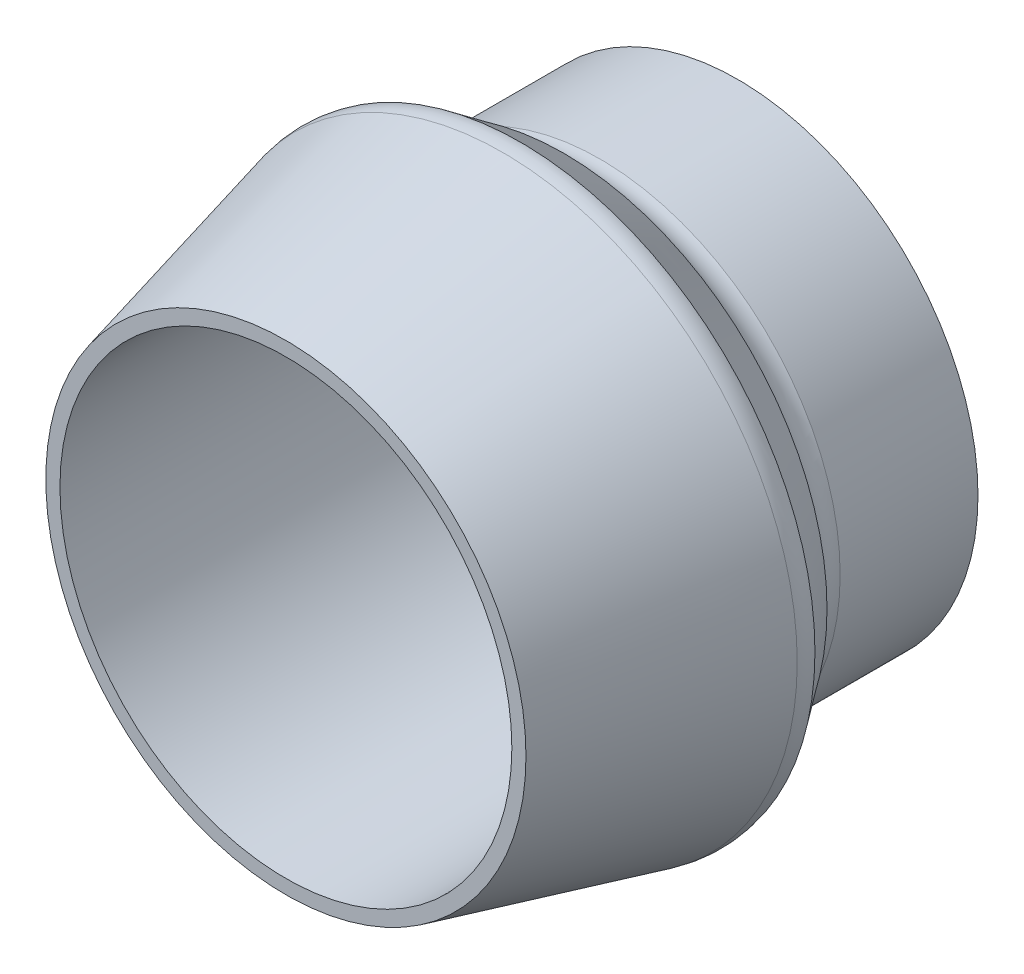
from build123d import *


with BuildPart() as part:
    # Esboço1 → Revolução4 (revolve)
    with BuildSketch(Plane(origin=(0, 0, 0), x_dir=(0, 0, -1), z_dir=(1, 0, 0)), mode=Mode.PRIVATE) as revolu_o4_sk:
        with BuildLine():
            Line((-36.699570276, 4.133360134), (-36.092161543, 3.695324027))
            ThreePointArc((-36.092161543, 3.695324027), (-35.905826449, 3.430249421), (-35.58663159, 3.374572178))
            Line((-35.58663159, 3.374572178), (-33.65, 3.374572178))
            Line((-33.65, 3.374572178), (-33.65, 3.175))
            Line((-33.65, 3.175), (-40, 3.175))
            Line((-40, 3.175), (-40, 3.3734375))
            Line((-40, 3.3734375), (-36.951032326, 4.135679419))
            ThreePointArc((-36.951032326, 4.135679419), (-36.825153111, 4.150586903), (-36.699570276, 4.133360134))
        make_face()
    revolve(revolu_o4_sk.sketch.rotate(Axis((0, 0, 40), (0, 0, -1)), 90), axis=Axis((0, 0, 40), (0, 0, -1)))


solid = part.part
